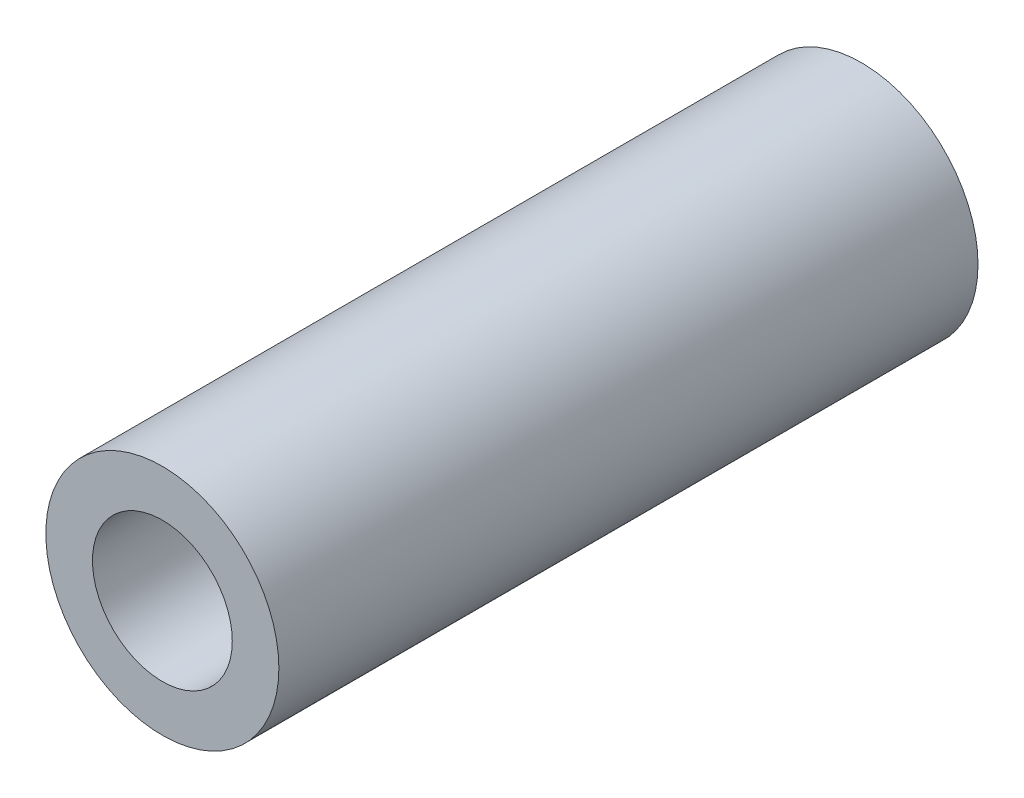
from build123d import *

# Parameters (mm, degrees)
SKETCH1_R           = 2.5
SKETCH1_R_2         = 1.5
BOSS_EXTRUDE1_DEPTH = 15


with BuildPart() as part:
    # Sketch1 → Boss-Extrude1 (new body)
    with BuildSketch(Plane.XY):
        with Locations((-25.032859693, 16.533479235)):
            Circle(SKETCH1_R)
        with Locations((-25.032859693, 16.533479235)):
            Circle(SKETCH1_R_2, mode=Mode.SUBTRACT)
    extrude(amount=BOSS_EXTRUDE1_DEPTH)


solid = part.part
